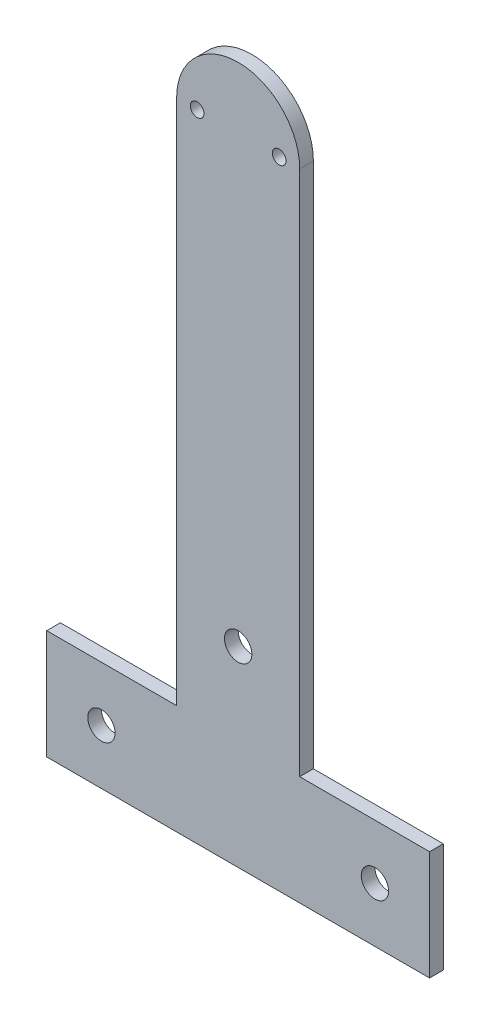
from build123d import *

# Parameters (mm, degrees)
SKETCH_1_R      = 2
SKETCH_1_R_2    = 1
EXTRUDE_1_DEPTH = 2


with BuildPart() as part:
    # 草图1 → 凸台-拉伸1 (new body)
    with BuildSketch(Plane.XY):
        with BuildLine():
            Line((-22.340449028, 112.565520938), (-22.340449028, 35.565520938))
            Line((-22.340449028, 35.565520938), (-41.340449028, 35.565520938))
            Line((-41.340449028, 35.565520938), (-41.340449028, 19.565520938))
            Line((-41.340449028, 19.565520938), (14.659550972, 19.565520938))
            Line((14.659550972, 19.565520938), (14.659550972, 35.565520938))
            Line((14.659550972, 35.565520938), (-4.340449028, 35.565520938))
            Line((-4.340449028, 35.565520938), (-4.340449028, 112.565520938))
            ThreePointArc((-4.340449028, 112.565520938), (-13.340449028, 121.565520938), (-22.340449028, 112.565520938))
        make_face()
        with Locations((-33.340449028, 27.565520938)):
            Circle(SKETCH_1_R, mode=Mode.SUBTRACT)
        with Locations(Location((6.659550972, 27.565520938, 0), (0, 0, 180))):
            Circle(SKETCH_1_R, mode=Mode.SUBTRACT)
        with Locations((-7.340449028, 112.565520938)):
            Circle(SKETCH_1_R_2, mode=Mode.SUBTRACT)
        with Locations(Location((-19.340449028, 112.565520938, 0), (0, 0, 180))):
            Circle(SKETCH_1_R_2, mode=Mode.SUBTRACT)
        with Locations((-13.340449028, 47.565520938)):
            Circle(SKETCH_1_R, mode=Mode.SUBTRACT)
    extrude(amount=EXTRUDE_1_DEPTH)


solid = part.part
